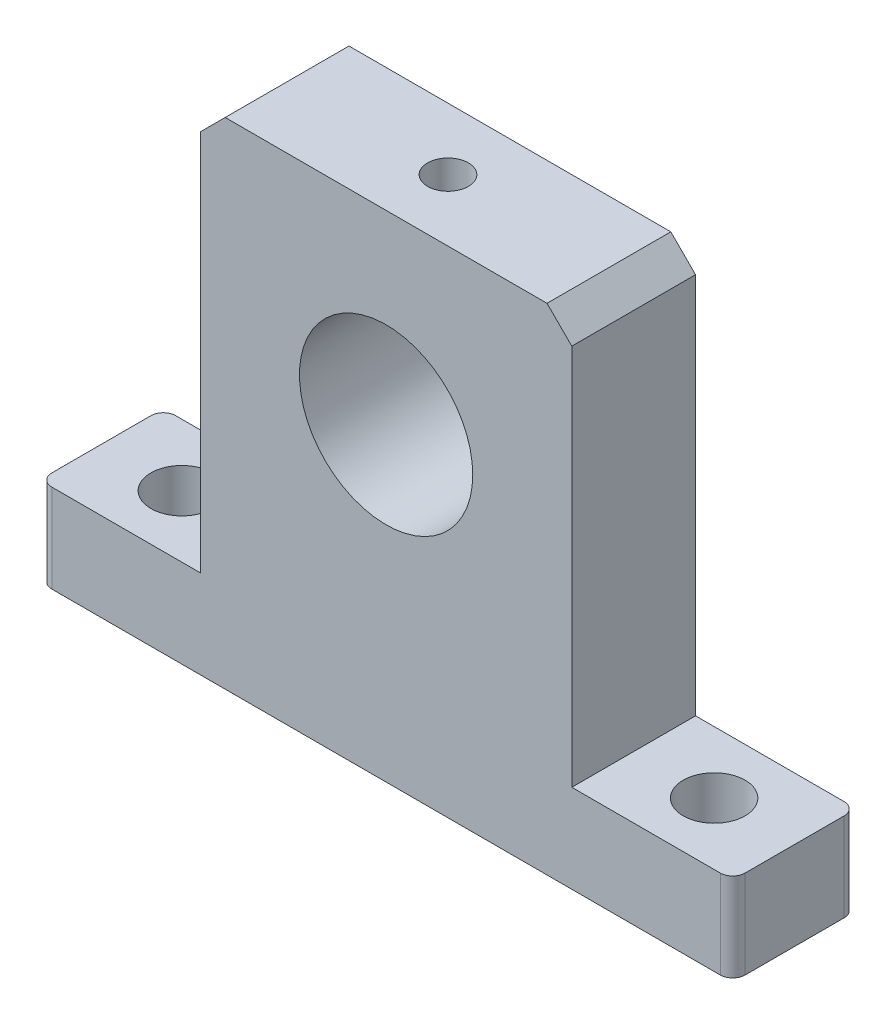
from build123d import *

# Parameters (mm, degrees)
SKETCH1_W                       = 56
SKETCH1_H                       = 40
BOSS_EXTRUDE1_DEPTH             = 10
SKETCH2_W                       = 13
SKETCH2_H                       = 32.863436123
CUT_EXTRUDE1_DEPTH              = 55.723267722
SKETCH3_W                       = 13
SKETCH3_H                       = 32.863436123
CUT_EXTRUDE2_DEPTH              = 55.723267722
F_14_0_14_DIAMETER_HOLE1_D      = 14
F_3_3_3_3_DIAMETER_HOLE1_REACH  = 58.473
F_3_3_3_3_DIAMETER_HOLE1_BORE_R = 1.65
F_5_0_5_DIAMETER_HOLE1_D        = 5
CHAMFER1_SIZE                   = 2
FILLET1_R                       = 1


with BuildPart() as part:
    # Sketch1 → Boss-Extrude1 (new body)
    with BuildSketch(Plane.XY.offset(10)):
        with Locations((-10.59030837, 17.488986784)):
            Rectangle(SKETCH1_W, SKETCH1_H)
    extrude(amount=-BOSS_EXTRUDE1_DEPTH)

    # Sketch2 → Cut-Extrude1 (cut, through all)
    with BuildSketch(Plane(origin=(0, 0, 0), x_dir=(-1, 0, 0), z_dir=(0, 0, -1))):
        with Locations((32.09030837, 21.057268723)):
            Rectangle(SKETCH2_W, SKETCH2_H)
    extrude(amount=-CUT_EXTRUDE1_DEPTH, mode=Mode.SUBTRACT)

    # Sketch3 → Cut-Extrude2 (cut, through all)
    with BuildSketch(Plane(origin=(0, 0, 0), x_dir=(-1, 0, 0), z_dir=(0, 0, -1))):
        with Locations((-10.90969163, 21.057268723)):
            Rectangle(SKETCH3_W, SKETCH3_H)
    extrude(amount=-CUT_EXTRUDE2_DEPTH, mode=Mode.SUBTRACT)

    # Ø14.0 (14) Diameter Hole1 (through all)
    with Locations(Plane.XY.offset(10)):
        with Locations((-10.59030837, 22.488986784)):
            Hole(F_14_0_14_DIAMETER_HOLE1_D / 2)

    # Ø3.3 (3.3) Diameter Hole1 bore → Ø3.3 (3.3) Diameter Hole1 (cut, up to next)
    with BuildSketch(Plane(origin=(0, 37.488986784, 0), x_dir=(1, 0, 0), z_dir=(0, 1, 0)), mode=Mode.PRIVATE) as f_3_3_3_3_diameter_hole1_sk1:
        with Locations((-10.59030837, -5)):
            Circle(F_3_3_3_3_DIAMETER_HOLE1_BORE_R)
    f_3_3_3_3_diameter_hole1_tool1 = extrude(f_3_3_3_3_diameter_hole1_sk1.sketch, amount=-F_3_3_3_3_DIAMETER_HOLE1_REACH, mode=Mode.PRIVATE) & part.part
    add(f_3_3_3_3_diameter_hole1_tool1.solids().sort_by_distance((-10.590308, 37.488987, 5))[0], mode=Mode.SUBTRACT)

    # Ø5.0 (5) Diameter Hole1 (through all)
    with Locations(Plane(origin=(0, 4.625550661, 0), x_dir=(1, 0, 0), z_dir=(0, 1, 0))):
        with Locations((-32.09030837, -5), (10.90969163, -5)):
            Hole(F_5_0_5_DIAMETER_HOLE1_D / 2)

    # Chamfer1
    chamfer1_edges = [part.edges().sort_by_distance(p)[0] for p in [
        (-25.59030837, 37.488986784, 5),
        (4.40969163, 37.488986784, 5),
    ]]
    chamfer(chamfer1_edges, length=CHAMFER1_SIZE)

    # Fillet1
    fillet1_edges = [part.edges().sort_by_distance(p)[0] for p in [
        (17.40969163, 1.057268722, 0),
        (-38.59030837, 1.057268722, 10),
        (-38.59030837, 1.057268722, 0),
        (17.40969163, 1.057268722, 10),
    ]]
    fillet(fillet1_edges, radius=FILLET1_R)


solid = part.part
